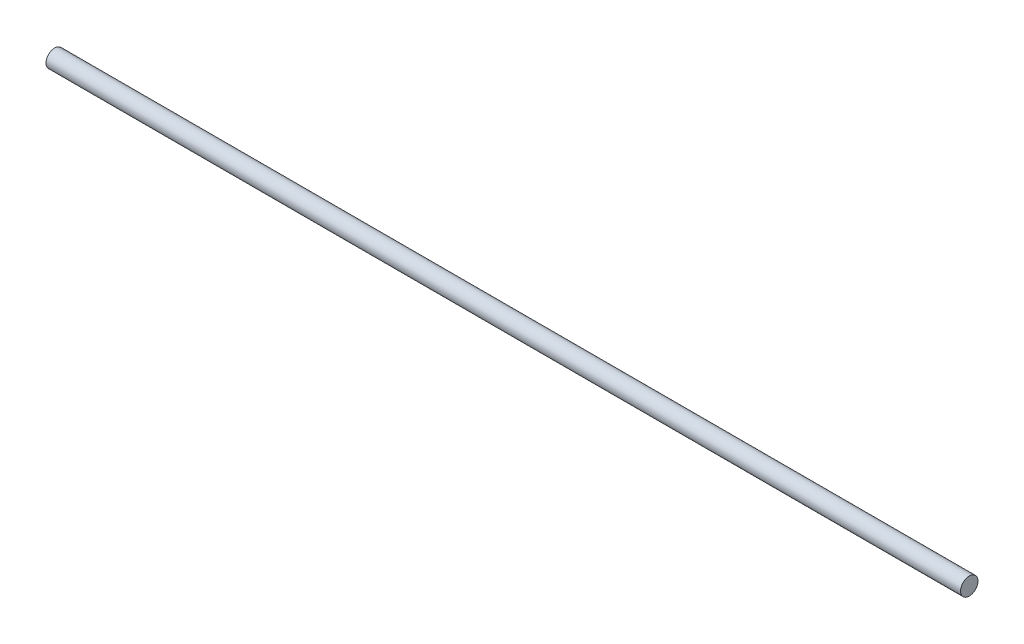
from build123d import *

# Parameters (mm, degrees)
ESBO_O1_R                = 4
RESSALTO_EXTRUS_O1_DEPTH = 420


with BuildPart() as part:
    # Esboço1 → Ressalto-extrusão1 (new body)
    with BuildSketch(Plane(origin=(0, 0, 0), x_dir=(0, 0, -1), z_dir=(1, 0, 0))):
        Circle(ESBO_O1_R)
    extrude(amount=RESSALTO_EXTRUS_O1_DEPTH)


solid = part.part
